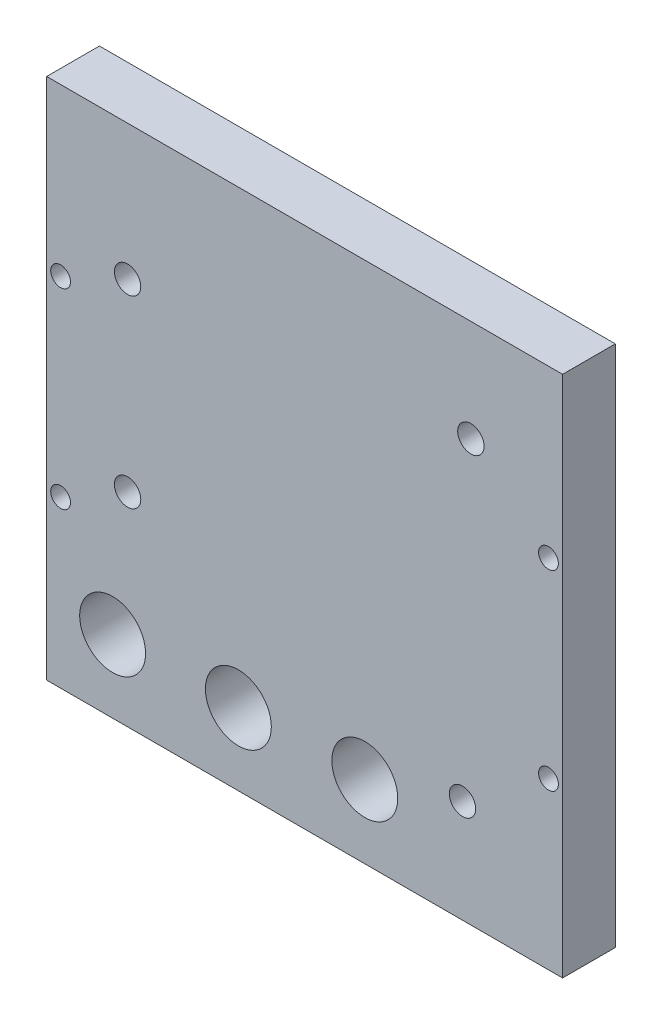
from build123d import *

# Parameters (mm, degrees)
SKETCH1_W           = 78.25
SKETCH1_H           = 79.3
SKETCH1_R           = 5
SKETCH1_R_2         = 2
SKETCH1_R_3         = 1.5
BOSS_EXTRUDE1_DEPTH = 8


with BuildPart() as part:
    # Sketch1 → Boss-Extrude1 (new body)
    with BuildSketch(Plane.XY):
        with Locations((0.176122561, 0.352245122)):
            Rectangle(SKETCH1_W, SKETCH1_H)
        with Locations((-9.875194839, -28.39441243)):
            Circle(SKETCH1_R, mode=Mode.SUBTRACT)
        with Locations((9.301122561, -28.217424669)):
            Circle(SKETCH1_R, mode=Mode.SUBTRACT)
        with Locations(Location((-28.948877439, -28.303646558, 0), (0, 0, 180))):
            Circle(SKETCH1_R, mode=Mode.SUBTRACT)
        with Locations((-26.677304512, 19.502245122)):
            Circle(SKETCH1_R_2, mode=Mode.SUBTRACT)
        with Locations((-26.677304512, -8.437754878)):
            Circle(SKETCH1_R_2, mode=Mode.SUBTRACT)
        with Locations((24.122695488, -23.677754878)):
            Circle(SKETCH1_R_2, mode=Mode.SUBTRACT)
        with Locations((25.392695488, 24.582245122)):
            Circle(SKETCH1_R_2, mode=Mode.SUBTRACT)
        with Locations((-36.837723202, 14.814078865)):
            Circle(SKETCH1_R_3, mode=Mode.SUBTRACT)
        with Locations((-36.837723202, -14.185921135)):
            Circle(SKETCH1_R_3, mode=Mode.SUBTRACT)
        with Locations((37.162276798, -14.185921135)):
            Circle(SKETCH1_R_3, mode=Mode.SUBTRACT)
        with Locations((37.162276798, 14.814078865)):
            Circle(SKETCH1_R_3, mode=Mode.SUBTRACT)
    extrude(amount=BOSS_EXTRUDE1_DEPTH)


solid = part.part
